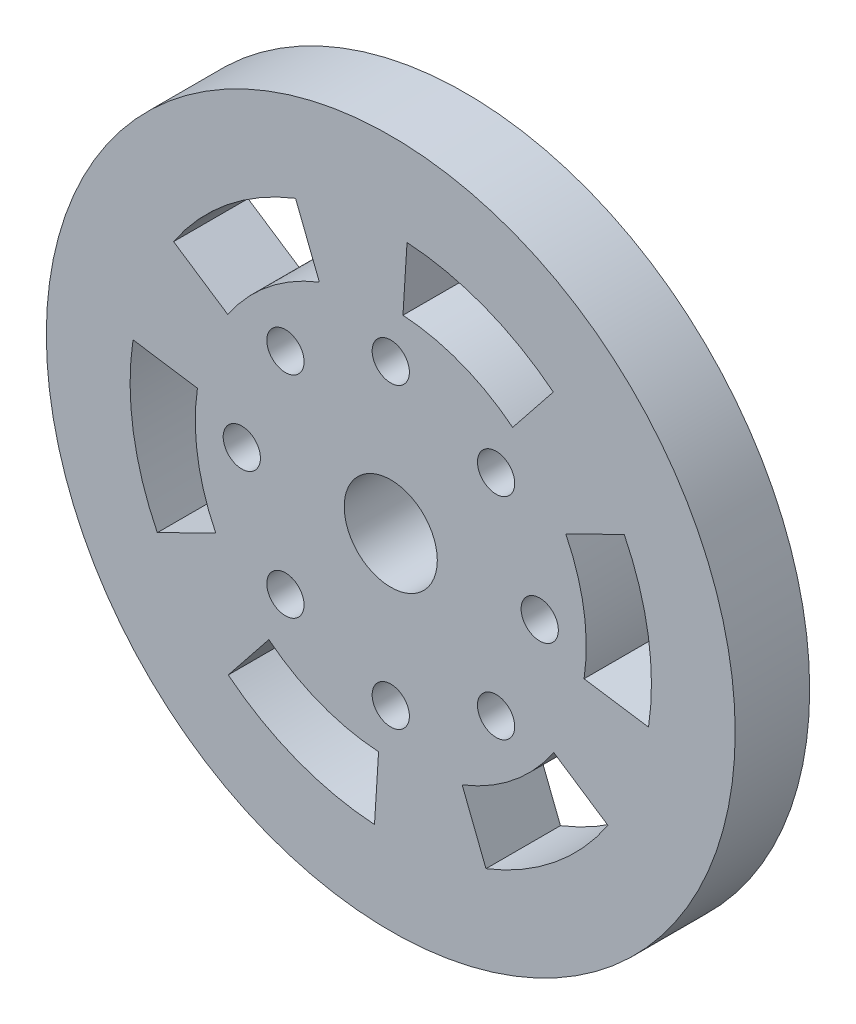
from build123d import *

# Parameters (mm, degrees)
ESQUISSE1_R             = 22.2
BOSS_EXTRU_1_DEPTH      = 4.8
ESQUISSE2_R             = 3
ESQUISSE2_R_2           = 1.2
ENL_V_MAT_EXTRU_1_DEPTH = 32.760352643


with BuildPart() as part:
    # Esquisse1 → Boss.-Extru.1 (new body)
    with BuildSketch(Plane.XY):
        Circle(ESQUISSE1_R)
    extrude(amount=BOSS_EXTRU_1_DEPTH)

    # Esquisse2 → Enlèv. mat.-Extru.1 (cut, through all)
    with BuildSketch(Plane.XY.offset(4.8)):
        Circle(ESQUISSE2_R)
        with Locations((9.6, 0)):
            Circle(ESQUISSE2_R_2)
        with Locations((6.788225099, -6.788225099)):
            Circle(ESQUISSE2_R_2)
        with Locations((0, -9.6)):
            Circle(ESQUISSE2_R_2)
        with Locations((-6.788225099, -6.788225099)):
            Circle(ESQUISSE2_R_2)
        with Locations((-9.6, 0)):
            Circle(ESQUISSE2_R_2)
        with Locations((-6.788225099, 6.788225099)):
            Circle(ESQUISSE2_R_2)
        with Locations((0, 9.6)):
            Circle(ESQUISSE2_R_2)
        with Locations((6.788225099, 6.788225099)):
            Circle(ESQUISSE2_R_2)
        with BuildLine():
            Line((-13.996985601, 9.29109219), (-10.497739201, 6.968319142))
            ThreePointArc((-10.497739201, 6.968319142), (-7.916457842, 9.802535144), (-4.602380866, 11.729368711))
            Line((-4.602380866, 11.729368711), (-6.136507821, 15.639158282))
            ThreePointArc((-6.136507821, 15.639158282), (-10.555277122, 13.070046858), (-13.996985601, 9.29109219))
        make_face()
        with BuildLine():
            Line((1.047829065, 16.767291202), (0.785871799, 12.575468401))
            ThreePointArc((0.785871799, 12.575468401), (4.531015535, 11.757121171), (7.856740841, 9.850463103))
            Line((7.856740841, 9.850463103), (10.475654455, 13.133950804))
            ThreePointArc((10.475654455, 13.133950804), (6.041354047, 15.676161561), (1.047829065, 16.767291202))
        make_face()
        with BuildLine():
            Line((15.044814666, 7.476199012), (11.283610999, 5.607149259))
            ThreePointArc((11.283610999, 5.607149259), (12.447473377, 1.954586027), (12.459121707, -1.878905608))
            Line((12.459121707, -1.878905608), (16.612162276, -2.505207477))
            ThreePointArc((16.612162276, -2.505207477), (16.596631169, 2.606114703), (15.044814666, 7.476199012))
        make_face()
        with BuildLine():
            Line((13.996985601, -9.29109219), (10.497739201, -6.968319142))
            ThreePointArc((10.497739201, -6.968319142), (7.916457842, -9.802535144), (4.602380866, -11.729368711))
            Line((4.602380866, -11.729368711), (6.136507821, -15.639158282))
            ThreePointArc((6.136507821, -15.639158282), (10.555277122, -13.070046858), (13.996985601, -9.29109219))
        make_face()
        with BuildLine():
            Line((-1.047829065, -16.767291202), (-0.785871799, -12.575468401))
            ThreePointArc((-0.785871799, -12.575468401), (-4.531015535, -11.757121171), (-7.856740841, -9.850463103))
            Line((-7.856740841, -9.850463103), (-10.475654455, -13.133950804))
            ThreePointArc((-10.475654455, -13.133950804), (-6.041354047, -15.676161561), (-1.047829065, -16.767291202))
        make_face()
        with BuildLine():
            Line((-15.044814666, -7.476199012), (-11.283610999, -5.607149259))
            ThreePointArc((-11.283610999, -5.607149259), (-12.447473377, -1.954586027), (-12.459121707, 1.878905608))
            Line((-12.459121707, 1.878905608), (-16.612162276, 2.505207477))
            ThreePointArc((-16.612162276, 2.505207477), (-16.596631169, -2.606114703), (-15.044814666, -7.476199012))
        make_face()
    extrude(amount=-ENL_V_MAT_EXTRU_1_DEPTH, mode=Mode.SUBTRACT)


solid = part.part
